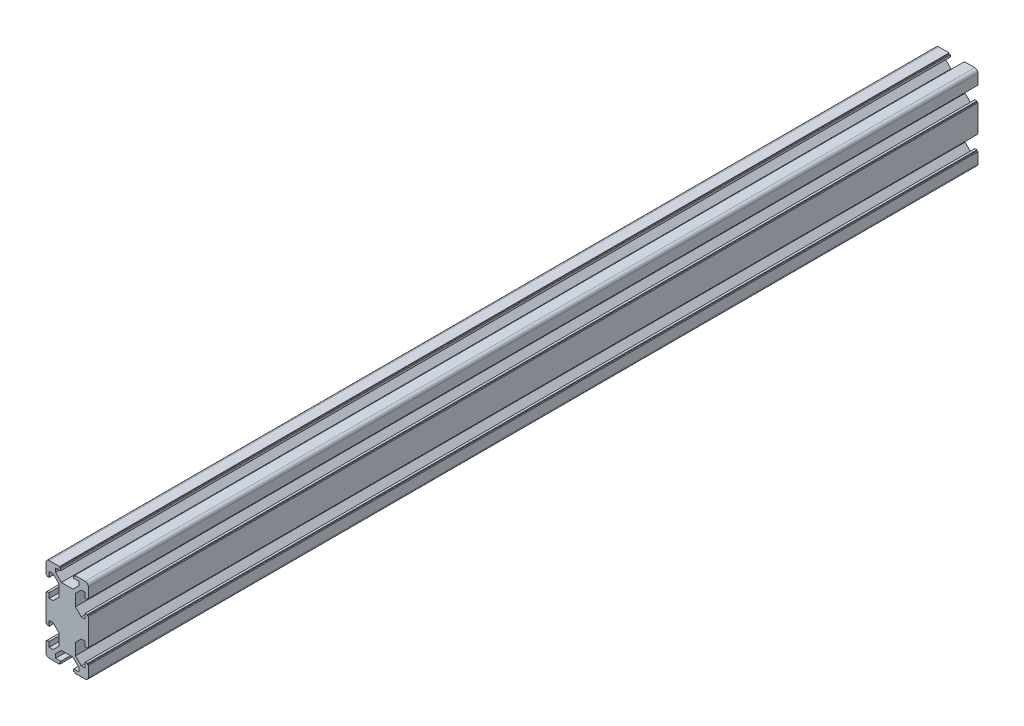
from build123d import *

# Parameters (mm, degrees)
EXTRUDE_1_DEPTH = 420


with BuildPart() as part:
    # Sketch1 → 凸台-拉伸1 (new body)
    with BuildSketch(Plane.XY):
        with BuildLine():
            Line((-3.6, 10), (-3.6, 9.5))
            Line((-3.6, 9.5), (-3.1, 9.5))
            Line((-3.1, 9.5), (-3.1, 8.5))
            Line((-3.1, 8.5), (-5.5, 8.5))
            Line((-5.5, 8.5), (-5.5, 6.65))
            Line((-5.5, 6.65), (-2.75, 3.9))
            Line((-2.75, 3.9), (2.75, 3.9))
            Line((2.75, 3.9), (5.5, 6.65))
            Line((5.5, 6.65), (5.5, 8.5))
            Line((5.5, 8.5), (3.1, 8.5))
            Line((3.1, 8.5), (3.1, 9.5))
            Line((3.1, 9.5), (3.6, 9.5))
            Line((3.6, 9.5), (3.6, 10))
            Line((3.6, 10), (8.5, 10))
            ThreePointArc((8.5, 10), (9.560660172, 9.560660172), (10, 8.5))
            Line((10, 8.5), (10, 3.6))
            Line((10, 3.6), (9.5, 3.6))
            Line((9.5, 3.6), (9.5, 3.1))
            Line((9.5, 3.1), (8.5, 3.1))
            Line((8.5, 3.1), (8.5, 5.5))
            Line((8.5, 5.5), (6.65, 5.5))
            Line((6.65, 5.5), (3.9, 2.75))
            Line((3.9, 2.75), (3.9, -2.75))
            Line((3.9, -2.75), (6.65, -5.5))
            Line((6.65, -5.5), (8.5, -5.5))
            Line((8.5, -5.5), (8.5, -3.1))
            Line((8.5, -3.1), (9.5, -3.1))
            Line((9.5, -3.1), (9.5, -3.6))
            Line((9.5, -3.6), (10, -3.6))
            Line((10, -3.6), (10, -16.4))
            Line((10, -16.4), (9.5, -16.4))
            Line((9.5, -16.4), (9.5, -16.9))
            Line((9.5, -16.9), (8.5, -16.9))
            Line((8.5, -16.9), (8.5, -14.5))
            Line((8.5, -14.5), (6.65, -14.5))
            Line((6.65, -14.5), (3.9, -17.25))
            Line((3.9, -17.25), (3.9, -22.75))
            Line((3.9, -22.75), (6.65, -25.5))
            Line((6.65, -25.5), (8.5, -25.5))
            Line((8.5, -25.5), (8.5, -23.1))
            Line((8.5, -23.1), (9.5, -23.1))
            Line((9.5, -23.1), (9.5, -23.6))
            Line((9.5, -23.6), (10, -23.6))
            Line((10, -23.6), (10, -28.5))
            ThreePointArc((10, -28.5), (9.560660172, -29.560660172), (8.5, -30))
            Line((8.5, -30), (3.6, -30))
            Line((3.6, -30), (3.6, -29.5))
            Line((3.6, -29.5), (3.1, -29.5))
            Line((3.1, -29.5), (3.1, -28.5))
            Line((3.1, -28.5), (5.5, -28.5))
            Line((5.5, -28.5), (5.5, -26.65))
            Line((5.5, -26.65), (2.75, -23.9))
            Line((2.75, -23.9), (-2.75, -23.9))
            Line((-2.75, -23.9), (-5.5, -26.65))
            Line((-5.5, -26.65), (-5.5, -28.5))
            Line((-5.5, -28.5), (-3.1, -28.5))
            Line((-3.1, -28.5), (-3.1, -29.5))
            Line((-3.1, -29.5), (-3.6, -29.5))
            Line((-3.6, -29.5), (-3.6, -30))
            Line((-3.6, -30), (-8.5, -30))
            ThreePointArc((-8.5, -30), (-9.560660172, -29.560660172), (-10, -28.5))
            Line((-10, -28.5), (-10, -23.6))
            Line((-10, -23.6), (-9.5, -23.6))
            Line((-9.5, -23.6), (-9.5, -23.1))
            Line((-9.5, -23.1), (-8.5, -23.1))
            Line((-8.5, -23.1), (-8.5, -25.5))
            Line((-8.5, -25.5), (-6.65, -25.5))
            Line((-6.65, -25.5), (-3.9, -22.75))
            Line((-3.9, -22.75), (-3.9, -17.25))
            Line((-3.9, -17.25), (-6.65, -14.5))
            Line((-6.65, -14.5), (-8.5, -14.5))
            Line((-8.5, -14.5), (-8.5, -16.9))
            Line((-8.5, -16.9), (-9.5, -16.9))
            Line((-9.5, -16.9), (-9.5, -16.4))
            Line((-9.5, -16.4), (-10, -16.4))
            Line((-10, -16.4), (-10, -3.6))
            Line((-10, -3.6), (-9.5, -3.6))
            Line((-9.5, -3.6), (-9.5, -3.1))
            Line((-9.5, -3.1), (-8.5, -3.1))
            Line((-8.5, -3.1), (-8.5, -5.5))
            Line((-8.5, -5.5), (-6.65, -5.5))
            Line((-6.65, -5.5), (-3.9, -2.75))
            Line((-3.9, -2.75), (-3.9, 2.75))
            Line((-3.9, 2.75), (-6.65, 5.5))
            Line((-6.65, 5.5), (-8.5, 5.5))
            Line((-8.5, 5.5), (-8.5, 3.1))
            Line((-8.5, 3.1), (-9.5, 3.1))
            Line((-9.5, 3.1), (-9.5, 3.6))
            Line((-9.5, 3.6), (-10, 3.6))
            Line((-10, 3.6), (-10, 8.5))
            ThreePointArc((-10, 8.5), (-9.560660172, 9.560660172), (-8.5, 10))
            Line((-8.5, 10), (-3.6, 10))
        make_face()
    extrude(amount=EXTRUDE_1_DEPTH)


solid = part.part
